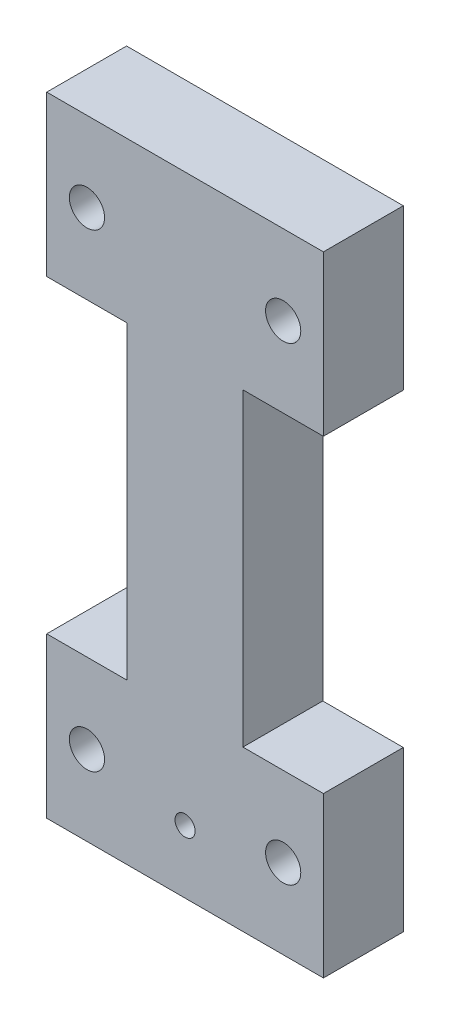
from build123d import *

# Parameters (mm, degrees)
SKETCH1_R           = 1.4
BOSS_EXTRUDE1_DEPTH = 6.35
SKETCH2_R           = 0.8
CUT_EXTRUDE1_DEPTH  = 29.041442545


with BuildPart() as part:
    # Sketch1 → Boss-Extrude1 (new body)
    with BuildSketch(Plane.XY):
        Polygon((11, -25), (11, -12.3), (4.6, -12.3), (4.6, 12.3), (11, 12.3), (11, 25), (-11, 25), (-11, 12.3), (-4.6, 12.3), (-4.6, -12.3), (-11, -12.3), (-11, -25), align=None)
        with Locations((7.8, -18.65)):
            Circle(SKETCH1_R, mode=Mode.SUBTRACT)
        with Locations((-7.8, -18.65)):
            Circle(SKETCH1_R, mode=Mode.SUBTRACT)
        with Locations((7.8, 18.65)):
            Circle(SKETCH1_R, mode=Mode.SUBTRACT)
        with Locations((-7.8, 18.65)):
            Circle(SKETCH1_R, mode=Mode.SUBTRACT)
    extrude(amount=BOSS_EXTRUDE1_DEPTH)

    # Sketch2 → Cut-Extrude1 (cut, through all)
    with BuildSketch(Plane.XY.offset(6.35)):
        with Locations((0, -20)):
            Circle(SKETCH2_R)
    extrude(amount=-CUT_EXTRUDE1_DEPTH, mode=Mode.SUBTRACT)


solid = part.part
